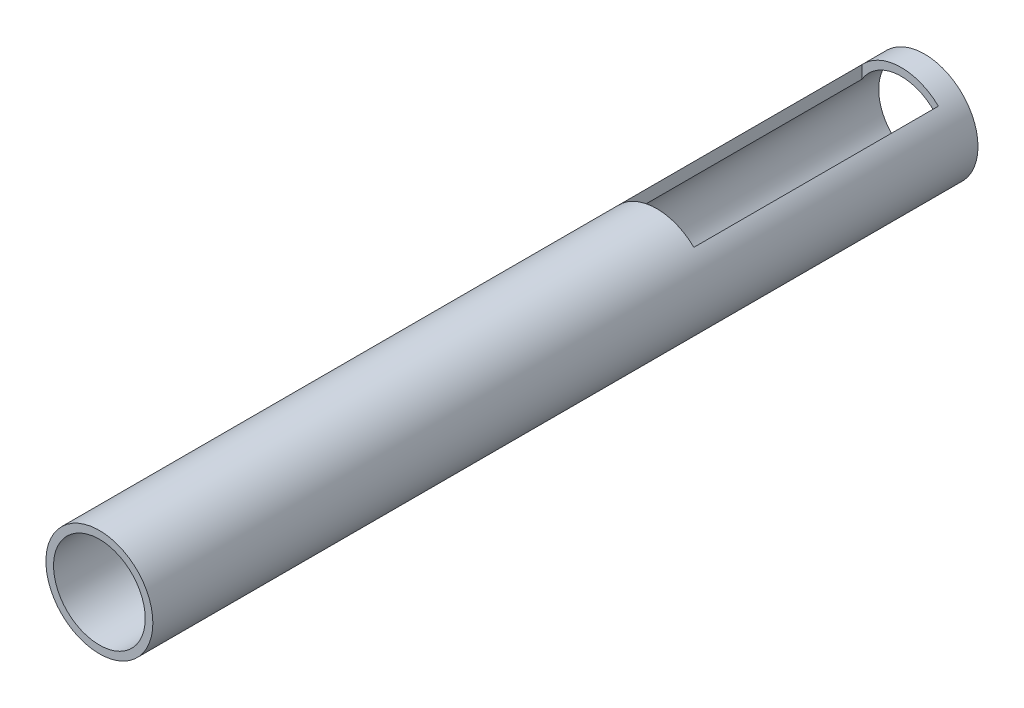
from build123d import *

# Parameters (mm, degrees)
SKETCH3_R           = 44.45
SKETCH3_R_2         = 38.1
BOSS_EXTRUDE3_DEPTH = 685.8
SKETCH4_W           = 63.5
SKETCH4_H           = 203.2
CUT_EXTRUDE2_DEPTH  = 685.8


with BuildPart() as part:
    # Sketch3 → Boss-Extrude3 (new body)
    with BuildSketch(Plane.XY):
        Circle(SKETCH3_R)
        Circle(SKETCH3_R_2, mode=Mode.SUBTRACT)
    extrude(amount=BOSS_EXTRUDE3_DEPTH)

    # Sketch4 → Cut-Extrude2 (cut)
    with BuildSketch(Plane(origin=(0, 0, 0), x_dir=(1, 0, 0), z_dir=(0, 1, 0))):
        with Locations((-0.892426947, -120.953055133)):
            Rectangle(SKETCH4_W, SKETCH4_H)
    extrude(amount=CUT_EXTRUDE2_DEPTH, mode=Mode.SUBTRACT)


solid = part.part
